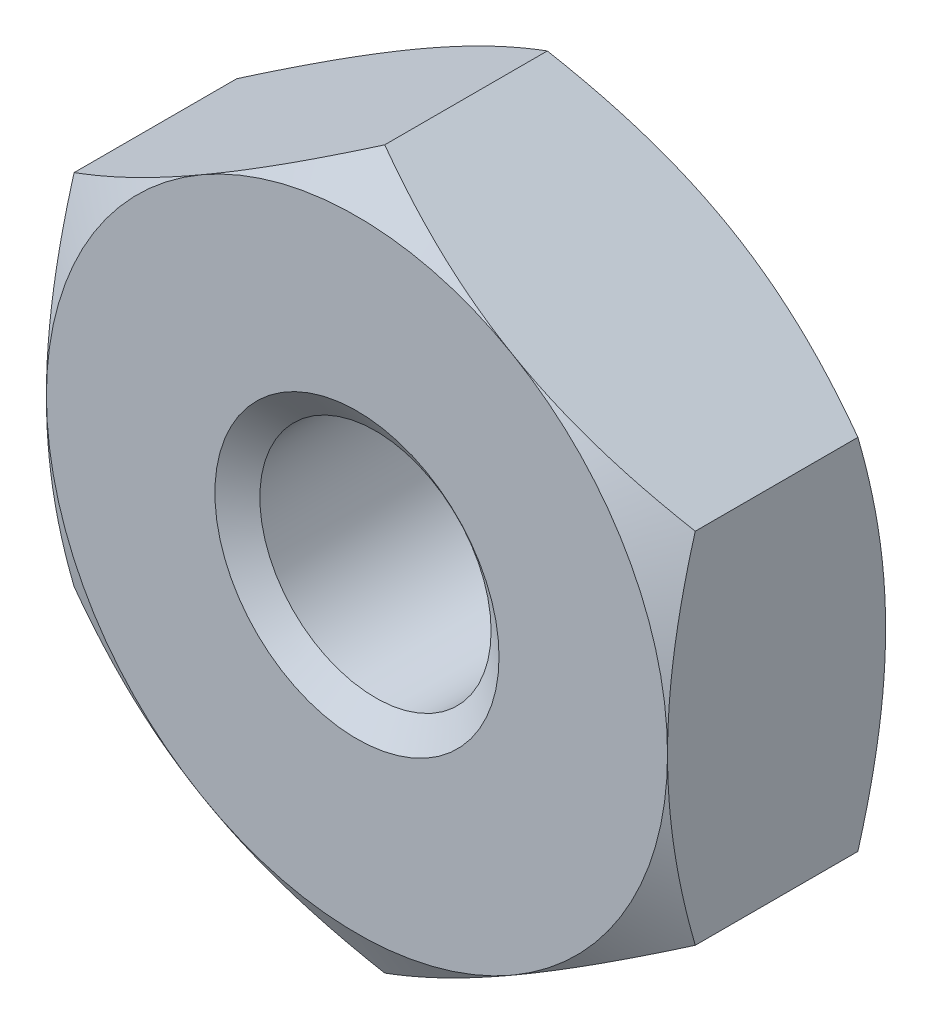
from build123d import *

# Parameters (mm, degrees)
BASENUT_START = -1.6764
BASENUTSKE_R  = 0.889
BASENUT_DEPTH = 1.6764


with BuildPart() as part:
    # BaseNutSke → BaseNut (new body)
    with BuildSketch(Plane.XY.offset(BASENUT_START)):
        Polygon((2.3876, 1.378481503), (2.3876, -1.378481503), (0, -2.756963005), (-2.3876, -1.378481503), (-2.3876, 1.378481503), (0, 2.756963005), align=None)
        Circle(BASENUTSKE_R, mode=Mode.SUBTRACT)
    extrude(amount=BASENUT_DEPTH)

    # Sketch3 → Double-Chamfer (revolve, cut)
    with BuildSketch(Plane(origin=(0, 0, 0), x_dir=(0, 0, -1), z_dir=(1, 0, 0))):
        Polygon((1.6764, 2.3876), (1.463148169, 2.756963005), (1.463148169, 15.456963005), (14.3764, 15.456963005), (14.3764, 2.3876), align=None)
        Polygon((0.213251831, 15.456963005), (-12.7, 15.456963005), (-12.7, 2.3876), (0, 2.3876), (0.213251831, 2.756963005), align=None)
    revolve(axis=Axis((0, 0, 0), (0, 0, -1)), mode=Mode.SUBTRACT)

    # EndChamferSketch → EndChamfer (revolve, cut)
    with BuildSketch(Plane(origin=(0, 0, 0), x_dir=(0, 0, -1), z_dir=(1, 0, 0)), mode=Mode.PRIVATE) as endchamfer_sk:
        Polygon((1.651, 1.0922), (1.494489611, 0.86868), (1.7018, 0.86868), (1.7018, 1.0922), align=None)
        Polygon((-0.0508, 1.0922), (0, 1.0922), (0.156510389, 0.86868), (-0.0508, 0.86868), align=None)
    revolve(endchamfer_sk.sketch.rotate(Axis((0, 0, -25.037505729), (0, 0, -1)), 90), axis=Axis((0, 0, -25.037505729), (0, 0, -1)), mode=Mode.SUBTRACT)


solid = part.part
